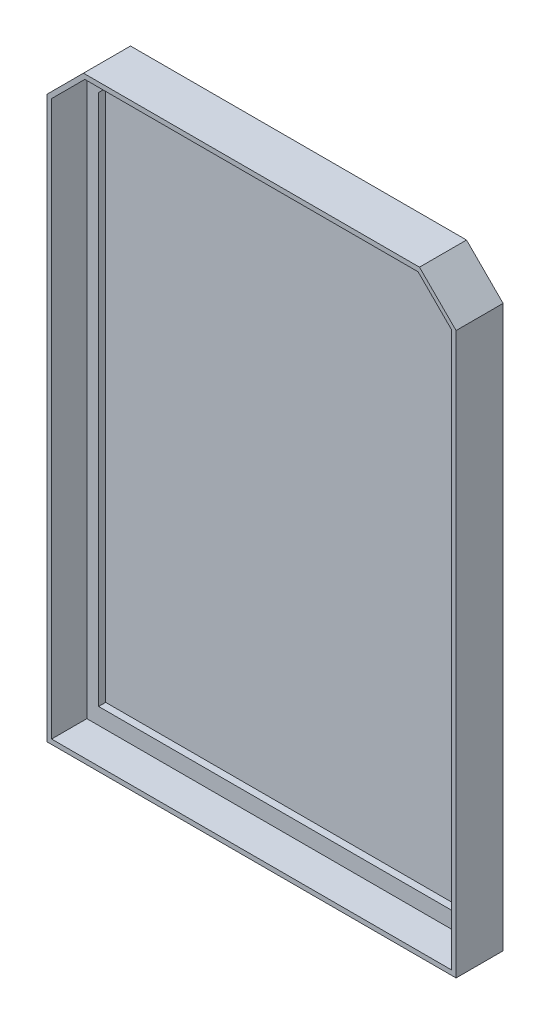
from build123d import *

# Parameters (mm, degrees)
BOSS_EXTRUDE1_DEPTH = 1.5
BOSS_EXTRUDE2_DEPTH = 9
BOSS_EXTRUDE3_DEPTH = 1
SKETCH4_R           = 6
SKETCH4_R_2         = 4.25
BOSS_EXTRUDE4_DEPTH = 30
FILLET1_R           = 20


with BuildPart() as part:
    # Sketch1 → Boss-Extrude1 (new body)
    with BuildSketch(Plane(origin=(0, 0, 0), x_dir=(0, 1, 0), z_dir=(0, 0, 1))):
        Polygon((-62.5, -42.5), (-62.5, 42.5), (55.428932188, 42.5), (62.5, 35.428932188), (62.5, -35.428932188), (55.428932188, -42.5), align=None)
        Polygon((54.050252532, 40), (59, 35.050252532), (59, -35.050252532), (54.050252532, -40), (-59, -40), (-59, 40), align=None, mode=Mode.SUBTRACT)
    extrude(amount=BOSS_EXTRUDE1_DEPTH)

    # Sketch2 → Boss-Extrude2 (add)
    with BuildSketch(Plane(origin=(0, 0, 0), x_dir=(0, 1, 0), z_dir=(0, 0, 1))):
        Polygon((-63.5, 43.5), (-63.5, -43.5), (55.721825407, -43.5), (63.5, -35.721825407), (63.5, 35.721825407), (55.721825407, 43.5), align=None)
        Polygon((-62.5, -42.5), (55.428932188, -42.5), (62.5, -35.428932188), (62.5, 35.428932188), (55.428932188, 42.5), (-62.5, 42.5), align=None, mode=Mode.SUBTRACT)
    extrude(amount=BOSS_EXTRUDE2_DEPTH)

    # Sketch3 → Boss-Extrude3 (add)
    with BuildSketch(Plane(origin=(0, 0, 0), x_dir=(0, 1, 0), z_dir=(0, 0, 1))):
        Polygon((63.5, 35.721825407), (55.721825407, 43.5), (-63.5, 43.5), (-63.5, -43.5), (55.721825407, -43.5), (63.5, -35.721825407), align=None)
    extrude(amount=-BOSS_EXTRUDE3_DEPTH)

    # Sketch4 → Boss-Extrude4 (add)
    with BuildSketch(Plane(origin=(0, 0, -1), x_dir=(1, 0, 0), z_dir=(0, 0, -1))):
        Circle(SKETCH4_R)
        with Locations(Location((0, 0, 0), (0, 0, 180))):
            Circle(SKETCH4_R_2, mode=Mode.SUBTRACT)
    extrude(amount=BOSS_EXTRUDE4_DEPTH)

    # Fillet1
    fillet1_edges = [part.edges().sort_by_distance(p)[0] for p in [
        (-6, 0, -1),
    ]]
    fillet(fillet1_edges, radius=FILLET1_R)


solid = part.part
